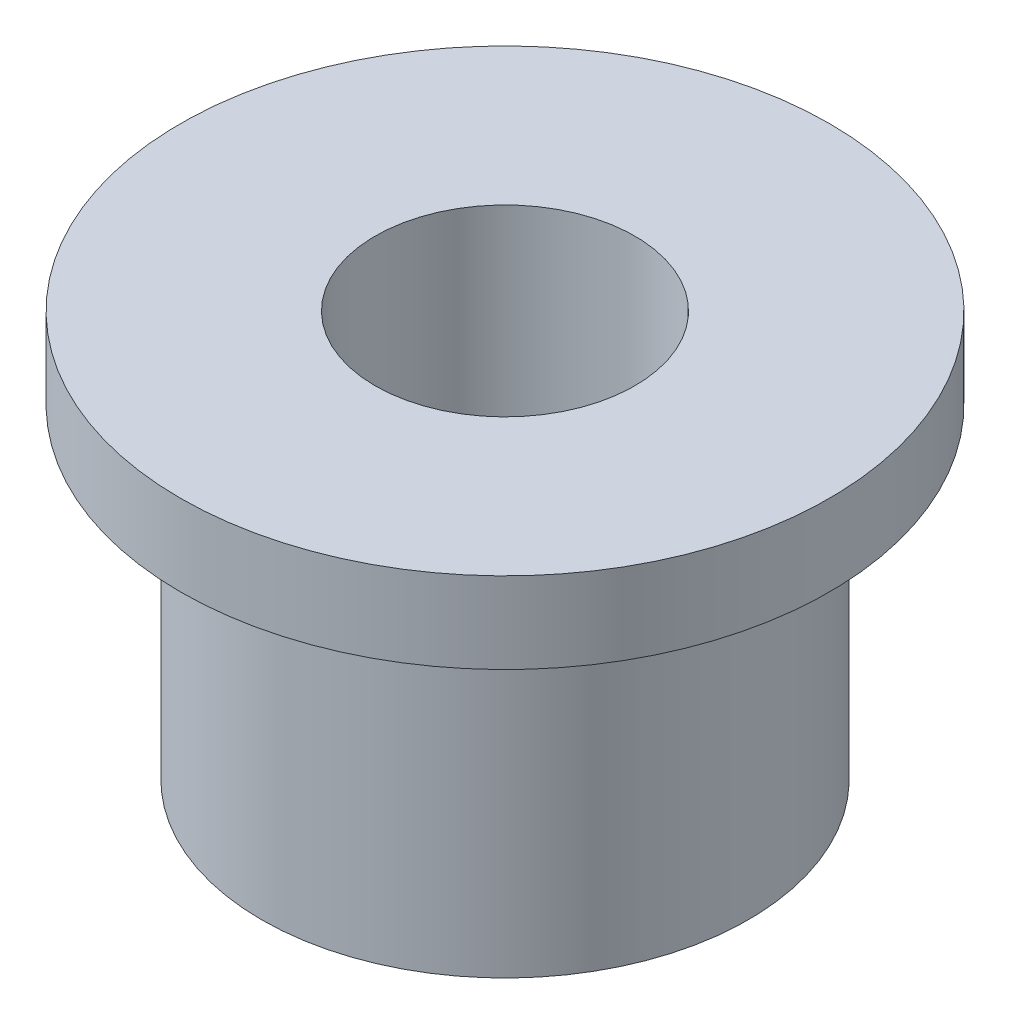
from build123d import *

# Parameters (mm, degrees)
ESBO_O1_R                = 3
ESBO_O1_R_2              = 1.6
RESSALTO_EXTRUS_O1_DEPTH = 5
RESSALTO_EXTRUS_O2_START = -1
ESBO_O2_R                = 4
ESBO_O2_R_2              = 3
RESSALTO_EXTRUS_O2_DEPTH = 1


with BuildPart() as part:
    # Esboço1 → Ressalto-extrusão1 (new body)
    with BuildSketch(Plane(origin=(0, 0, 0), x_dir=(1, 0, 0), z_dir=(0, 1, 0))):
        with Locations(Location((0, 0, 0), (0, 0, 270))):
            Circle(ESBO_O1_R)
        with Locations(Location((0, 0, 0), (0, 0, 270))):
            Circle(ESBO_O1_R_2, mode=Mode.SUBTRACT)
    extrude(amount=RESSALTO_EXTRUS_O1_DEPTH)

    # Esboço2 → Ressalto-extrusão2 (add)
    with BuildSketch(Plane(origin=(0, 5, 0), x_dir=(1, 0, 0), z_dir=(0, 1, 0)).offset(RESSALTO_EXTRUS_O2_START)):
        with Locations(Location((0, 0, 0), (0, 0, 270))):
            Circle(ESBO_O2_R)
        with Locations(Location((0, 0, 0), (0, 0, 270))):
            Circle(ESBO_O2_R_2, mode=Mode.SUBTRACT)
    extrude(amount=RESSALTO_EXTRUS_O2_DEPTH)


solid = part.part
